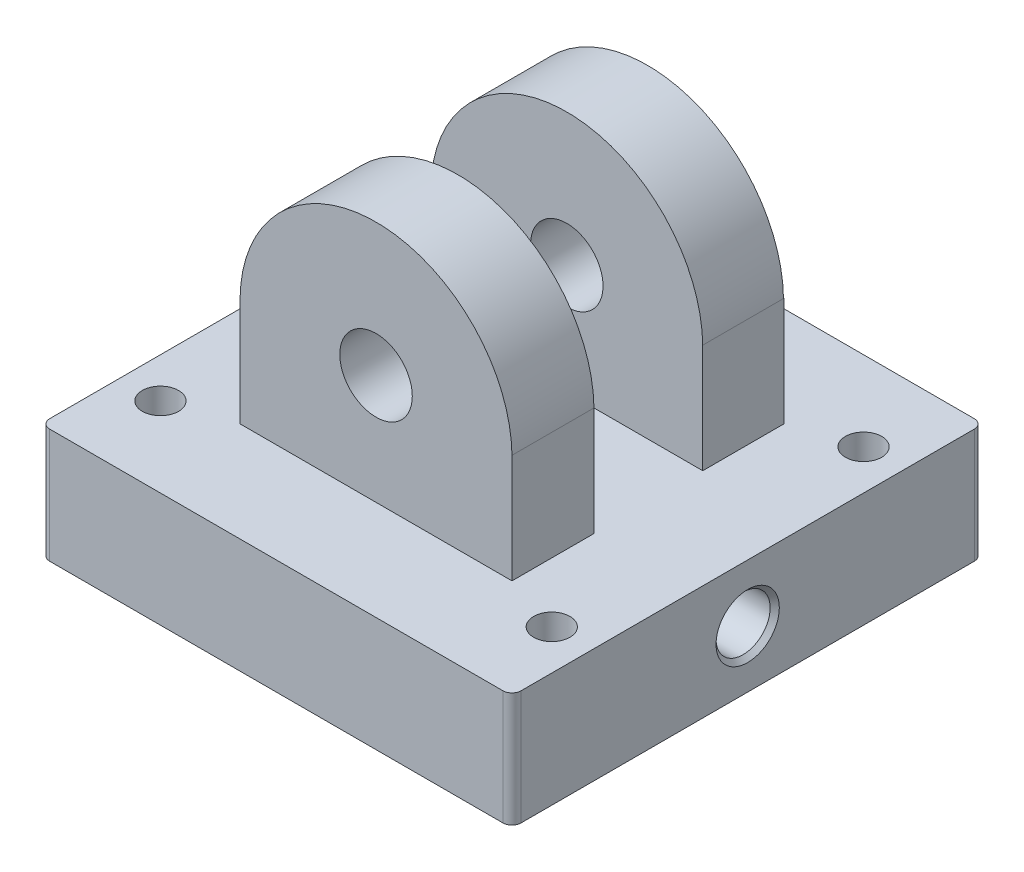
from build123d import *

# Parameters (mm, degrees)
BOSS_EXTRUDE1_DEPTH                    = 38.1
BOSS_EXTRUDE1_DEPTH_BACK               = 2
SKETCH1_W                              = 165.1
SKETCH1_H                              = 165.1
SKETCH2_W                              = 95.25
SKETCH2_H                              = 95.25
BOSS_EXTRUDE2_DEPTH                    = 38.1
BOSS_EXTRUDE5_DEPTH                    = 95.1
SKETCH5_R                              = 12.7
CUT_EXTRUDE1_DEPTH                     = 198.290297523
SKETCH6_W                              = 38.1
SKETCH6_H                              = 85.0398732
CUT_EXTRUDE2_DEPTH                     = 198.290297523
FILLET1_R                              = 3.175
SKETCH7_R                              = 26
CUT_EXTRUDE3_DEPTH                     = 36.83
SKETCH8_R                              = 76.2
SKETCH8_R_2                            = 69.85
CUT_EXTRUDE4_DEPTH                     = 8
F_1_2_14_NPSM_TAPPED_HOLE1_D           = 18.9738
F_1_2_14_NPSM_TAPPED_HOLE1_DEPTH       = 63.5
F_1_2_14_NPSM_TAPPED_HOLE1_CSINK_D     = 22.1742
F_1_2_14_NPSM_TAPPED_HOLE1_CSINK_ANGLE = 90
F_1_2_14_NPSM_TAPPED_HOLE1_TIP         = 5.700304607
SKETCH15_R                             = 6.35
BOSS_EXTRUDE6_DEPTH                    = 30
SKETCH16_R                             = 6.35
CUT_EXTRUDE5_DEPTH                     = 25
SKETCH17_R                             = 6.35
CUT_EXTRUDE6_DEPTH                     = 172.14027248


with BuildPart() as part:
    # Sketch1 → Boss-Extrude1 (new, two sides: drawn at the far end of the back side and taken through both)
    with BuildSketch(Plane(origin=(0, 0, 0), x_dir=(1, 0, 0), z_dir=(0, 1, 0)).offset(-BOSS_EXTRUDE1_DEPTH_BACK)):
        Rectangle(SKETCH1_W, SKETCH1_H)
    extrude(amount=BOSS_EXTRUDE1_DEPTH + BOSS_EXTRUDE1_DEPTH_BACK)

    # Sketch2 → Boss-Extrude2 (add)
    with BuildSketch(Plane(origin=(0, 38.1, 0), x_dir=(1, 0, 0), z_dir=(0, 1, 0))):
        Rectangle(SKETCH2_W, SKETCH2_H)
    extrude(amount=BOSS_EXTRUDE2_DEPTH)

    # Sketch4 → Boss-Extrude5 (add)
    with BuildSketch(Plane.XY.offset(47.625)):
        with BuildLine():
            Line((-47.625, 76.2), (47.625, 76.2))
            ThreePointArc((47.625, 76.2), (0, 123.1398732), (-47.625, 76.2))
        make_face()
    extrude(amount=-BOSS_EXTRUDE5_DEPTH)

    # Sketch5 → Cut-Extrude1 (cut, through all)
    with BuildSketch(Plane.XY.offset(47.625)):
        with Locations((0, 76.643842778)):
            Circle(SKETCH5_R)
    extrude(amount=-CUT_EXTRUDE1_DEPTH, mode=Mode.SUBTRACT)

    # Sketch6 → Cut-Extrude2 (cut, through all)
    with BuildSketch(Plane.ZY.offset(47.625)):
        with Locations((-0.1412698, 80.6199366)):
            Rectangle(SKETCH6_W, SKETCH6_H)
    extrude(amount=-CUT_EXTRUDE2_DEPTH, mode=Mode.SUBTRACT)

    # Fillet1
    fillet1_edges = [part.edges().sort_by_distance(p)[0] for p in [
        (82.55, 18.05, 82.55),
        (-82.55, 18.05, 82.55),
        (-82.55, 18.05, -82.55),
        (82.55, 18.05, -82.55),
    ]]
    fillet(fillet1_edges, radius=FILLET1_R)

    # Sketch7 → Cut-Extrude3 (cut)
    with BuildSketch(Plane.XZ.offset(2)):
        with Locations(Location((0, 0, 0), (0, 0, 270))):
            Circle(SKETCH7_R)
    extrude(amount=-CUT_EXTRUDE3_DEPTH, mode=Mode.SUBTRACT)

    # Sketch8 → Cut-Extrude4 (cut)
    with BuildSketch(Plane.XZ.offset(2)):
        with Locations(Location((0, 0, 0), (0, 0, 270))):
            Circle(SKETCH8_R)
        with Locations(Location((0, 0, 0), (0, 0, 270))):
            Circle(SKETCH8_R_2, mode=Mode.SUBTRACT)
    extrude(amount=-CUT_EXTRUDE4_DEPTH, mode=Mode.SUBTRACT)

    # 1/2-14 NPSM Tapped Hole1
    with Locations(Plane(origin=(82.55, 0, 0), x_dir=(0, 0, -1), z_dir=(1, 0, 0))):
        with Locations((0, 18.05)):
            CounterSinkHole(F_1_2_14_NPSM_TAPPED_HOLE1_D / 2, F_1_2_14_NPSM_TAPPED_HOLE1_CSINK_D / 2, depth=F_1_2_14_NPSM_TAPPED_HOLE1_DEPTH, counter_sink_angle=F_1_2_14_NPSM_TAPPED_HOLE1_CSINK_ANGLE)
            with Locations((0, 0, -(F_1_2_14_NPSM_TAPPED_HOLE1_DEPTH + F_1_2_14_NPSM_TAPPED_HOLE1_TIP / 2))):  # 118° drill point
                Cone(0, F_1_2_14_NPSM_TAPPED_HOLE1_D / 2, F_1_2_14_NPSM_TAPPED_HOLE1_TIP, mode=Mode.SUBTRACT)

    # Sketch15 → Boss-Extrude6 (add)
    with BuildSketch(Plane.XZ.offset(2)):
        with Locations(Location((50.301871098, 0, 0), (0, 0, 270))):
            Circle(SKETCH15_R)
    extrude(amount=-BOSS_EXTRUDE6_DEPTH)

    # Sketch16 → Cut-Extrude5 (cut)
    with BuildSketch(Plane.XZ.offset(2)):
        with Locations(Location((50.55, 0, 0), (0, 0, 270))):
            Circle(SKETCH16_R)
    extrude(amount=-CUT_EXTRUDE5_DEPTH, mode=Mode.SUBTRACT)

    # Sketch17 → Cut-Extrude6 (cut, through all)
    with BuildSketch(Plane.XZ.offset(2)):
        with Locations(Location((-68.538631425, 54.602865331, 0), (0, 0, 270))):
            Circle(SKETCH17_R)
        with Locations(Location((68.538631425, 54.602865331, 0), (0, 0, 270))):
            Circle(SKETCH17_R)
        with Locations(Location((-68.538631425, -54.602865331, 0), (0, 0, 270))):
            Circle(SKETCH17_R)
        with Locations(Location((68.538631425, -54.602865331, 0), (0, 0, 270))):
            Circle(SKETCH17_R)
    extrude(amount=-CUT_EXTRUDE6_DEPTH, mode=Mode.SUBTRACT)


solid = part.part
